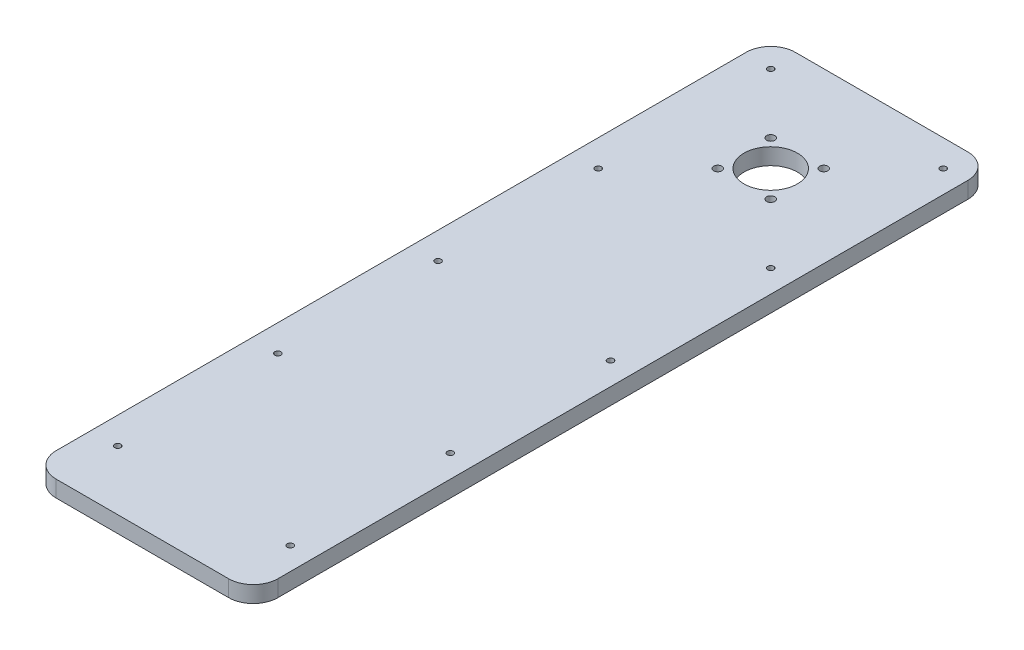
from build123d import *

# Parameters (mm, degrees)
SKETCH1_W           = 108
SKETCH1_H           = 360
SKETCH1_R           = 13
SKETCH1_R_2         = 1.5
SKETCH1_R_3         = 2
BOSS_EXTRUDE1_DEPTH = 8
FILLET1_R           = 12


with BuildPart() as part:
    # Sketch1 → Boss-Extrude1 (new body)
    with BuildSketch(Plane(origin=(0, 0, 0), x_dir=(1, 0, 0), z_dir=(0, 1, 0))):
        with Locations((-1, 0)):
            Rectangle(SKETCH1_W, SKETCH1_H)
        with Locations(Location((0, 125, 0), (0, 0, 270))):
            Circle(SKETCH1_R, mode=Mode.SUBTRACT)
        with Locations(Location((-42, 83, 0), (0, 0, 270))):
            Circle(SKETCH1_R_2, mode=Mode.SUBTRACT)
        with Locations(Location((-42, 167, 0), (0, 0, 270))):
            Circle(SKETCH1_R_2, mode=Mode.SUBTRACT)
        with Locations(Location((42, 167, 0), (0, 0, 270))):
            Circle(SKETCH1_R_2, mode=Mode.SUBTRACT)
        with Locations(Location((42, 83, 0), (0, 0, 270))):
            Circle(SKETCH1_R_2, mode=Mode.SUBTRACT)
        with Locations(Location((-12.904698757, 112.095301243, 0), (0, 0, 270))):
            Circle(SKETCH1_R_3, mode=Mode.SUBTRACT)
        with Locations(Location((-12.904698757, 137.904698757, 0), (0, 0, 270))):
            Circle(SKETCH1_R_3, mode=Mode.SUBTRACT)
        with Locations(Location((12.904698757, 137.904698757, 0), (0, 0, 270))):
            Circle(SKETCH1_R_3, mode=Mode.SUBTRACT)
        with Locations(Location((12.904698757, 112.095301243, 0), (0, 0, 270))):
            Circle(SKETCH1_R_3, mode=Mode.SUBTRACT)
        with Locations(Location((-42, 5, 0), (0, 0, 270))):
            Circle(SKETCH1_R_2, mode=Mode.SUBTRACT)
        with Locations(Location((-42, -73, 0), (0, 0, 270))):
            Circle(SKETCH1_R_2, mode=Mode.SUBTRACT)
        with Locations(Location((-42, -151, 0), (0, 0, 270))):
            Circle(SKETCH1_R_2, mode=Mode.SUBTRACT)
        with Locations(Location((42, -151, 0), (0, 0, 90))):
            Circle(SKETCH1_R_2, mode=Mode.SUBTRACT)
        with Locations(Location((42, -73, 0), (0, 0, 90))):
            Circle(SKETCH1_R_2, mode=Mode.SUBTRACT)
        with Locations(Location((42, 5, 0), (0, 0, 90))):
            Circle(SKETCH1_R_2, mode=Mode.SUBTRACT)
    extrude(amount=BOSS_EXTRUDE1_DEPTH)

    # Fillet1
    fillet1_edges = [part.edges().sort_by_distance(p)[0] for p in [
        (53, 4, 180),
        (-55, 4, 180),
        (-55, 4, -180),
        (53, 4, -180),
    ]]
    fillet(fillet1_edges, radius=FILLET1_R)


solid = part.part
